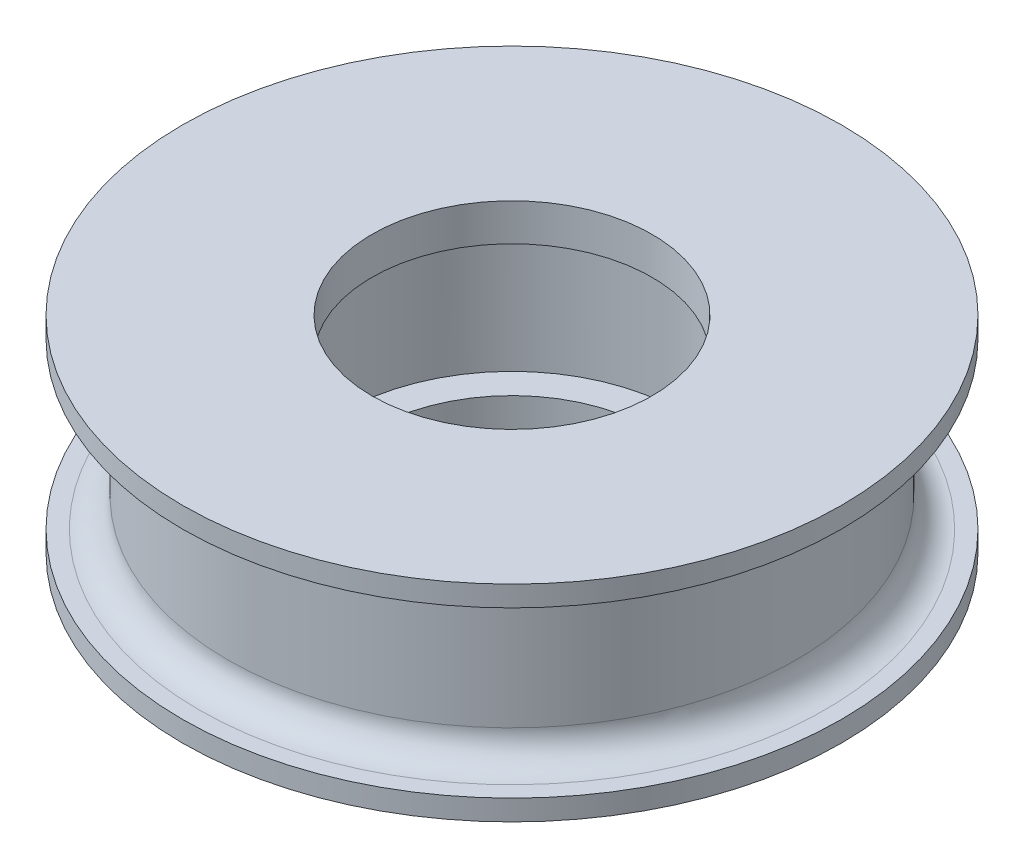
from build123d import *

# Parameters (mm, degrees)
SKETCH1_R           = 25.4
SKETCH1_R_2         = 13.081
BOSS_EXTRUDE1_DEPTH = 15.875
SKETCH7_R           = 15.875
SKETCH7_R_2         = 10.795
BOSS_EXTRUDE2_DEPTH = 2.8702
BOSS_EXTRUDE5_START = -2.8702
SKETCH9_R           = 15.875
SKETCH9_R_2         = 10.795
BOSS_EXTRUDE5_DEPTH = 2.8702


with BuildPart() as part:
    # Sketch1 → Boss-Extrude1 (new body)
    with BuildSketch(Plane(origin=(0, 0, 0), x_dir=(1, 0, 0), z_dir=(0, 1, 0))):
        with Locations(Location((0, 0, 0), (0, 0, 270))):
            Circle(SKETCH1_R)
        with Locations(Location((0, 0, 0), (0, 0, 270))):
            Circle(SKETCH1_R_2, mode=Mode.SUBTRACT)
    extrude(amount=BOSS_EXTRUDE1_DEPTH)

    # Sketch2 → Cut-Revolve1 (revolve, cut)
    with BuildSketch(Plane.XY, mode=Mode.PRIVATE) as cut_revolve1_sk:
        with BuildLine():
            Line((25.4, 14.2875), (24.13, 14.2875))
            ThreePointArc((24.13, 14.2875), (22.558455179, 13.636544821), (21.9075, 12.065))
            Line((21.9075, 12.065), (21.9075, 3.81))
            ThreePointArc((21.9075, 3.81), (22.558455179, 2.238455179), (24.13, 1.5875))
            Line((24.13, 1.5875), (25.4, 1.5875))
            Line((25.4, 1.5875), (25.4, 14.2875))
        make_face()
    revolve(cut_revolve1_sk.sketch.rotate(Axis((0, 0, 0), (0, 1, 0)), 90), axis=Axis((0, 0, 0), (0, 1, 0)), mode=Mode.SUBTRACT)

    # Sketch7 → Boss-Extrude2 (add)
    with BuildSketch(Plane.XZ):
        Circle(SKETCH7_R)
        with Locations(Location((0, 0, 0), (0, 0, 270))):
            Circle(SKETCH7_R_2, mode=Mode.SUBTRACT)
    extrude(amount=-BOSS_EXTRUDE2_DEPTH)

    # Sketch9 → Boss-Extrude5 (add)
    with BuildSketch(Plane(origin=(0, 15.875, 0), x_dir=(1, 0, 0), z_dir=(0, 1, 0)).offset(BOSS_EXTRUDE5_START)):
        Circle(SKETCH9_R)
        with Locations(Location((0, 0, 0), (0, 0, 90))):
            Circle(SKETCH9_R_2, mode=Mode.SUBTRACT)
    extrude(amount=BOSS_EXTRUDE5_DEPTH)


solid = part.part
